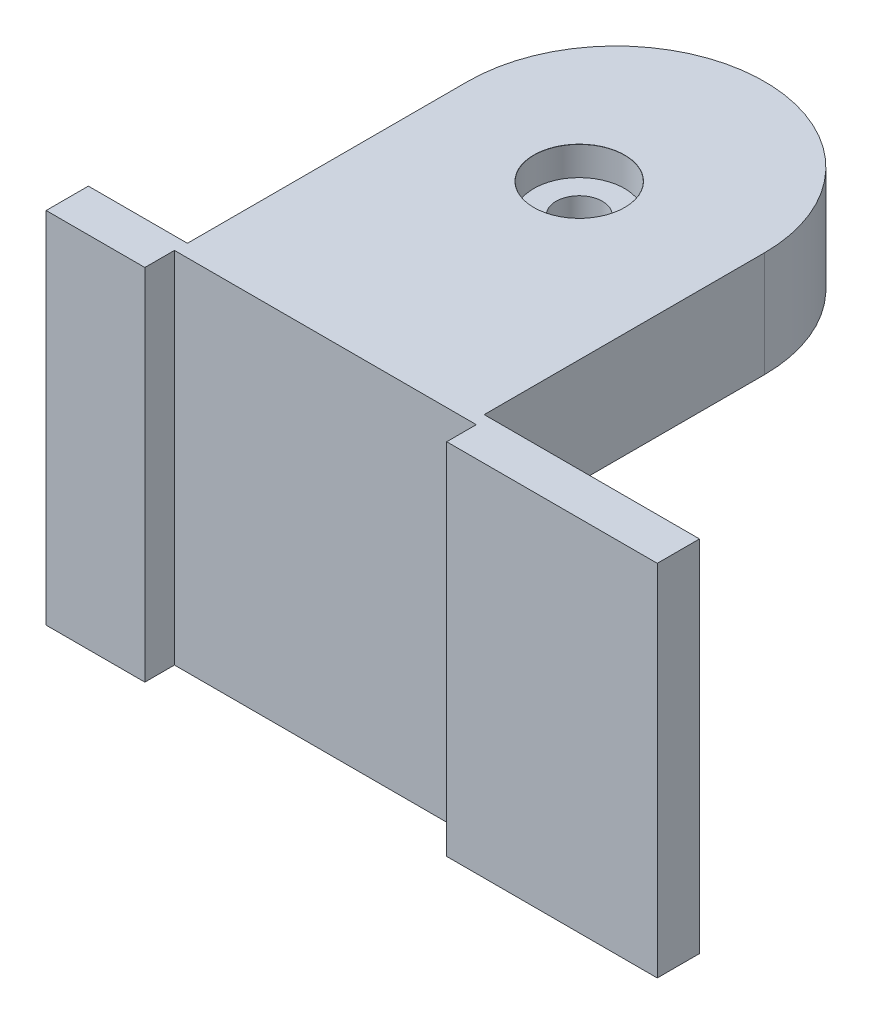
from build123d import *

# Parameters (mm, degrees)
ESBO_O2_W                   = 144.687309412
ESBO_O2_H                   = 85.02541091
RESSALTO_EXTRUS_O2_DEPTH    = 5
RESSALTO_EXTRUS_O7_DEPTH    = 25
CORTE_EXTRUS_O11_DEPTH      = 164.107898205
CORTE_EXTRUS_O11_DEPTH_BACK = 164.107898205
ESBO_O16_W                  = 71.463749888
ESBO_O16_H                  = 7.00897528


with BuildPart() as part:
    # Esboço2 → Ressalto-extrusão2 (new, symmetric)
    with BuildSketch(Plane.XY):
        with Locations((-17.293303914, 0.144110866)):
            Rectangle(ESBO_O2_W, ESBO_O2_H)
    extrude(amount=RESSALTO_EXTRUS_O2_DEPTH, both=True)

    # Esboço4 → Ressalto-extrusão7 (add)
    with BuildSketch(Plane(origin=(0, 42.656816321, 0), x_dir=(1, 0, 0), z_dir=(0, 1, 0))):
        with BuildLine():
            Line((-66.189068435, 5), (-66.189068435, 71.35749318))
            ThreePointArc((-66.189068435, 71.35749318), (-31.056742356, 106.489819259), (4.075583724, 71.35749318))
            Line((4.075583724, 71.35749318), (4.075583724, 5))
            Line((4.075583724, 5), (-66.189068435, 5))
        make_face()
    extrude(amount=-RESSALTO_EXTRUS_O7_DEPTH)

    # Esboço13 → Rebaixo para parafuso de cabeça sextavada de M101 (revolve, cut)
    with BuildSketch(Plane(origin=(-32.523283398, 42.656816321, -64.100430101), x_dir=(0, 0, 1), z_dir=(1, 0, 0))):
        Polygon((0, 0), (0, 85.025410909), (5.5, 85.025410909), (5.5, 6.85), (10.74, 6.85), (10.74, 0.025), (10.765, 0), align=None)
    revolve(axis=Axis((-32.523283398, 49.006816321, -64.100430101), (0, -1, 0)), mode=Mode.SUBTRACT)

    # Esboço16 → Corte-extrusão11 (cut, two sides: drawn at the far end of the back side and taken through both)
    with BuildSketch(Plane(origin=(0, 42.656816321, 0), x_dir=(1, 0, 0), z_dir=(0, 1, 0)).offset(-CORTE_EXTRUS_O11_DEPTH_BACK)):
        with Locations((-30.531670696, -1.49551236)):
            Rectangle(ESBO_O16_W, ESBO_O16_H)
    extrude(amount=CORTE_EXTRUS_O11_DEPTH + CORTE_EXTRUS_O11_DEPTH_BACK, mode=Mode.SUBTRACT)


solid = part.part
